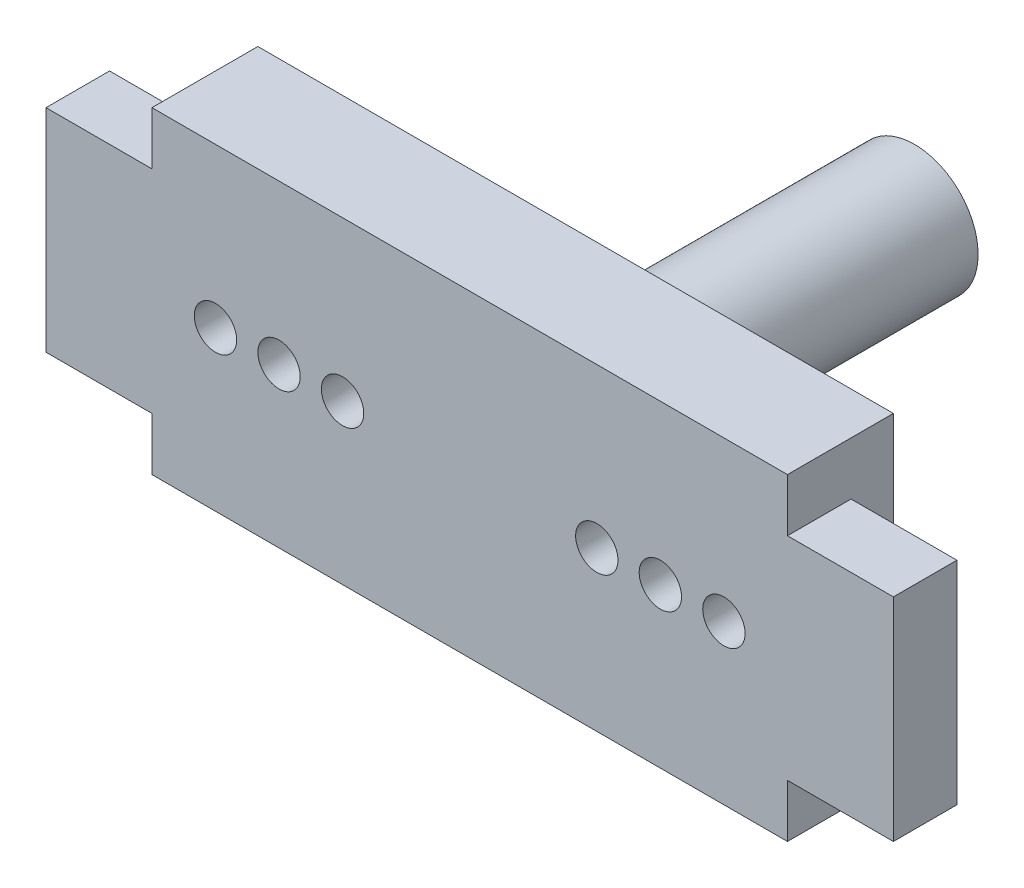
from build123d import *

# Parameters (mm, degrees)
SKETCH1_W           = 30
SKETCH1_H           = 5
BOSS_EXTRUDE1_DEPTH = 15
SKETCH3_R           = 1
CUT_EXTRUDE2_DEPTH  = 5
SKETCH5_W           = 5
SKETCH5_H           = 10
BOSS_EXTRUDE2_DEPTH = 3
SKETCH4_R           = 3
BOSS_EXTRUDE3_DEPTH = 16


with BuildPart() as part:
    # Sketch1 → Boss-Extrude1 (new body)
    with BuildSketch(Plane(origin=(0, 0, 0), x_dir=(1, 0, 0), z_dir=(0, 1, 0))):
        with Locations((-41.880536913, 26.290268456)):
            Rectangle(SKETCH1_W, SKETCH1_H)
    extrude(amount=BOSS_EXTRUDE1_DEPTH)

    # Sketch3 → Cut-Extrude2 (cut)
    with BuildSketch(Plane(origin=(0, 0, -28.790268456), x_dir=(-1, 0, 0), z_dir=(0, 0, -1))):
        with Locations((35.880536913, 7.5)):
            Circle(SKETCH3_R)
        with Locations((32.880536913, 7.5)):
            Circle(SKETCH3_R)
        with Locations((29.880536913, 7.5)):
            Circle(SKETCH3_R)
        with Locations((53.880536913, 7.5)):
            Circle(SKETCH3_R)
        with Locations((50.880536913, 7.5)):
            Circle(SKETCH3_R)
        with Locations((47.880536913, 7.5)):
            Circle(SKETCH3_R)
    extrude(amount=-CUT_EXTRUDE2_DEPTH, mode=Mode.SUBTRACT)

    # Sketch5 → Boss-Extrude2 (add)
    with BuildSketch(Plane.XY.offset(-23.790268456)):
        with Locations((-59.380536913, 7.5)):
            Rectangle(SKETCH5_W, SKETCH5_H)
        with Locations((-24.380536913, 7.5)):
            Rectangle(SKETCH5_W, SKETCH5_H)
    extrude(amount=-BOSS_EXTRUDE2_DEPTH)

    # Sketch4 → Boss-Extrude3 (add)
    with BuildSketch(Plane(origin=(0, 0, -28.790268456), x_dir=(-1, 0, 0), z_dir=(0, 0, -1))):
        with Locations((41.880536913, 7.5)):
            Circle(SKETCH4_R)
    extrude(amount=BOSS_EXTRUDE3_DEPTH)


solid = part.part
